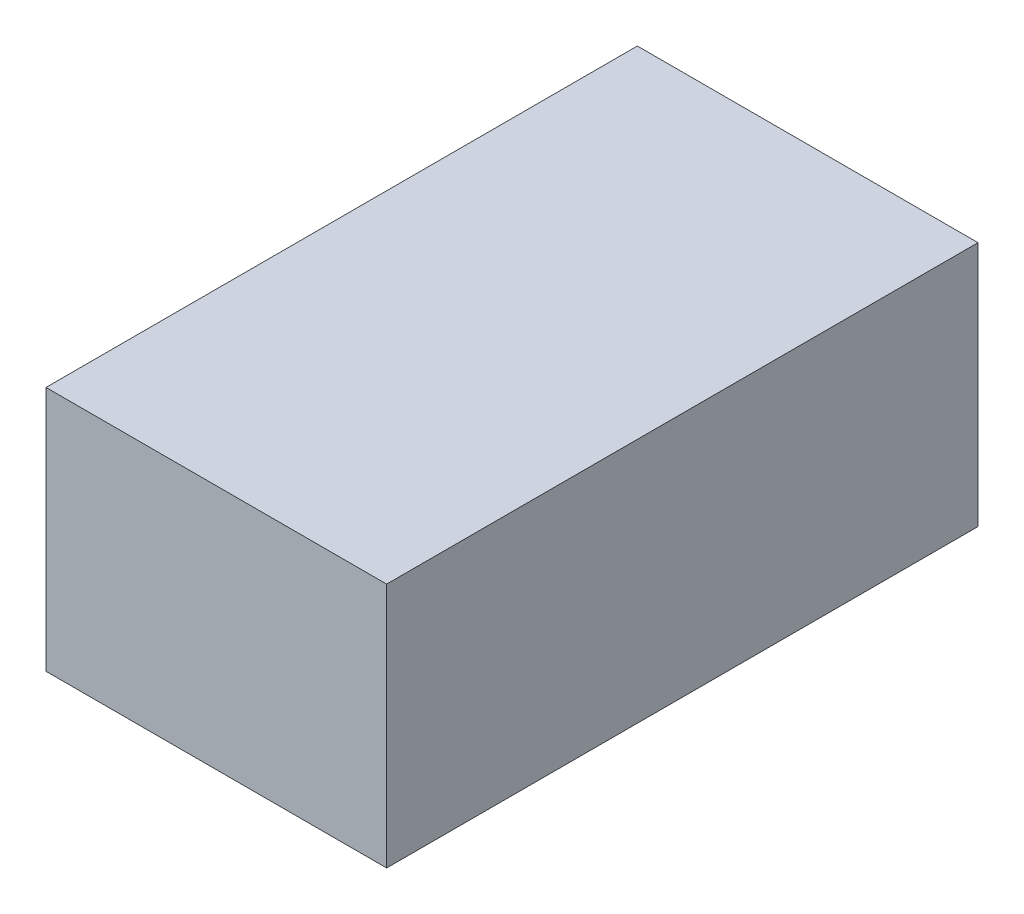
from build123d import *

# Parameters (mm, degrees)
SKETCH2_W           = 28.513595166
SKETCH2_H           = 20.580060423
BOSS_EXTRUDE1_DEPTH = 46.5
SKETCH3_W           = 28.513595166
SKETCH3_H           = 20.580060423
BOSS_EXTRUDE2_DEPTH = 3


with BuildPart() as part:
    # Sketch2 → Boss-Extrude1 (new body)
    with BuildSketch(Plane.XY):
        with Locations((-1.649546828, 5.419939578)):
            Rectangle(SKETCH2_W, SKETCH2_H)
        with BuildLine():
            Line((-12.649546828, 14.531722054), (9.350453172, 14.531722054))
            ThreePointArc((9.350453172, 14.531722054), (10.764666735, 13.945935617), (11.350453172, 12.531722054))
            Line((11.350453172, 12.531722054), (11.350453172, -0.568277946))
            ThreePointArc((11.350453172, -0.568277946), (10.764666735, -1.982491508), (9.350453172, -2.568277946))
            Line((9.350453172, -2.568277946), (-12.649546828, -2.568277946))
            ThreePointArc((-12.649546828, -2.568277946), (-14.06376039, -1.982491508), (-14.649546828, -0.568277946))
            Line((-14.649546828, -0.568277946), (-14.649546828, 12.531722054))
            ThreePointArc((-14.649546828, 12.531722054), (-14.06376039, 13.945935617), (-12.649546828, 14.531722054))
        make_face(mode=Mode.SUBTRACT)
    extrude(amount=BOSS_EXTRUDE1_DEPTH)

    # Sketch3 → Boss-Extrude2 (add)
    with BuildSketch(Plane.XY.offset(46.5)):
        with Locations((-1.649546828, 5.419939578)):
            Rectangle(SKETCH3_W, SKETCH3_H)
    extrude(amount=BOSS_EXTRUDE2_DEPTH)


solid = part.part
